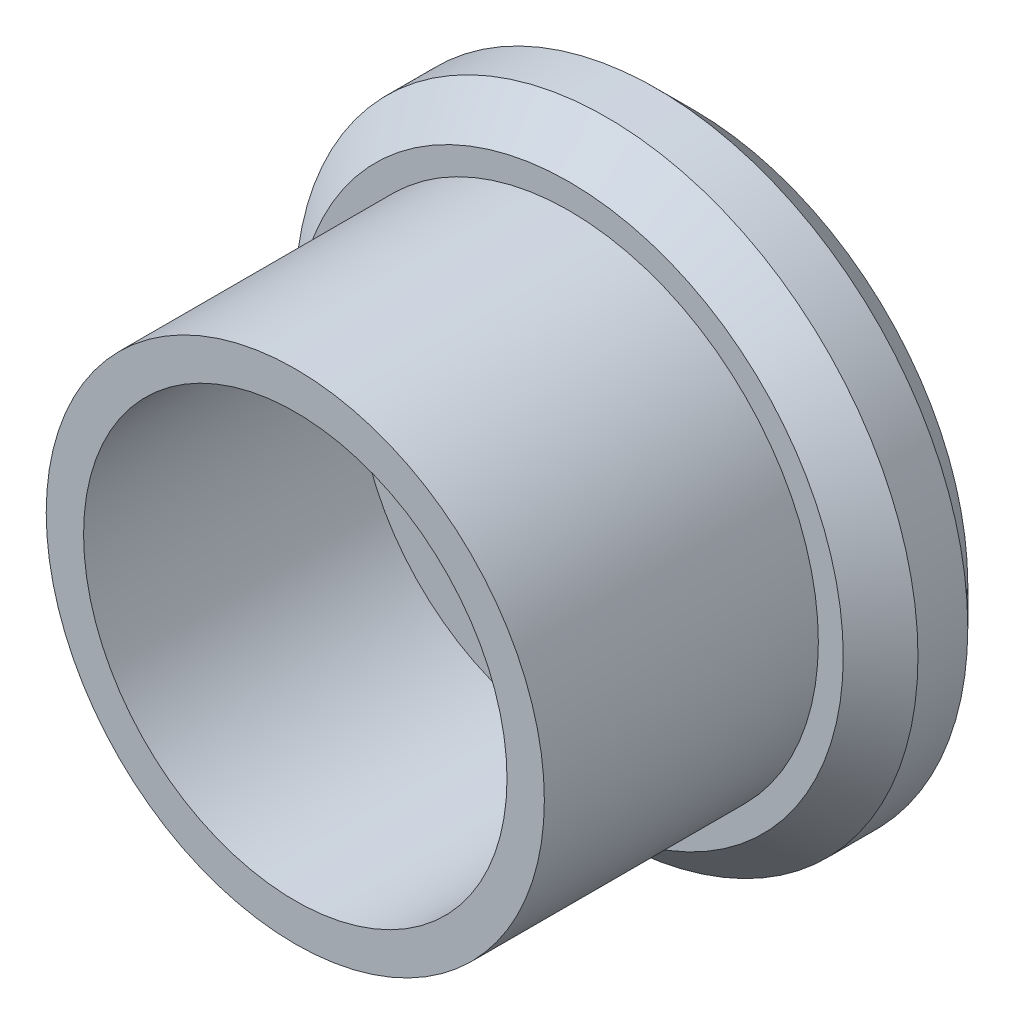
from build123d import *

# Parameters (mm, degrees)
SKETCH_1_R      = 20
SKETCH_1_R_2    = 17
EXTRUDE_1_DEPTH = 22
SKETCH_2_R      = 25
EXTRUDE_2_DEPTH = 10
CHAMFER_1_SIZE  = 3


with BuildPart() as part:
    # 草图1 → 凸台-拉伸1 (new body)
    with BuildSketch(Plane.XY):
        Circle(SKETCH_1_R)
        Circle(SKETCH_1_R_2, mode=Mode.SUBTRACT)
    extrude(amount=EXTRUDE_1_DEPTH)

    # 草图2 → 凸台-拉伸2 (add)
    with BuildSketch(Plane(origin=(0, 0, 0), x_dir=(-1, 0, 0), z_dir=(0, 0, -1))):
        Circle(SKETCH_2_R)
    extrude(amount=EXTRUDE_2_DEPTH)

    # 倒角1
    chamfer_1_edges = [part.edges().sort_by_distance(p)[0] for p in [
        (25, 0, 0),
        (25, 0, -10),
    ]]
    chamfer(chamfer_1_edges, length=CHAMFER_1_SIZE)


solid = part.part
